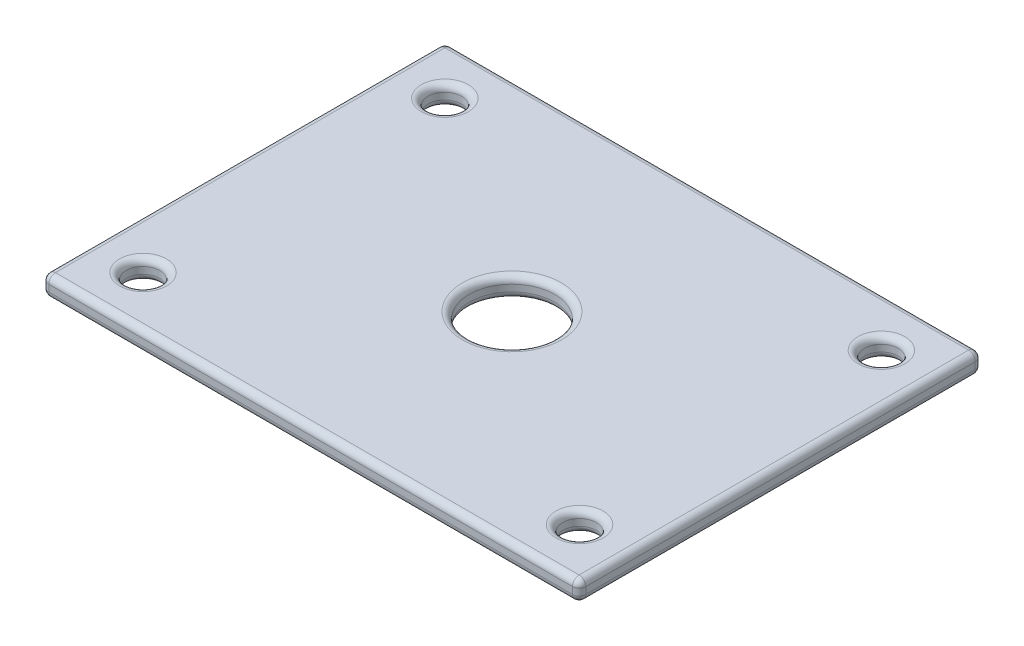
from build123d import *

# Parameters (mm, degrees)
SKETCH1_W           = 160
SKETCH1_H           = 120
BOSS_EXTRUDE1_DEPTH = 6
SKETCH2_R           = 5
SKETCH2_R_2         = 12.75
CUT_EXTRUDE1_DEPTH  = 151.018113468
FILLET1_R           = 2
SCALE_1_SCALE       = 0.5


with BuildPart() as part:
    # Sketch1 → Boss-Extrude1 (new body)
    with BuildSketch(Plane(origin=(0, 0, 0), x_dir=(1, 0, 0), z_dir=(0, 1, 0))):
        with Locations((28.264703914, -43.673469388)):
            Rectangle(SKETCH1_W, SKETCH1_H)
    extrude(amount=BOSS_EXTRUDE1_DEPTH)

    # Sketch2 → Cut-Extrude1 (cut, through all)
    with BuildSketch(Plane(origin=(0, 6, 0), x_dir=(1, 0, 0), z_dir=(0, 1, 0))):
        with Locations(Location((-36.735296086, 1.326530612, 0), (0, 0, 270))):
            Circle(SKETCH2_R)
        with Locations(Location((93.312703914, 1.326530612, 0), (0, 0, 270))):
            Circle(SKETCH2_R)
        with Locations(Location((93.312703914, -88.589469388, 0), (0, 0, 270))):
            Circle(SKETCH2_R)
        with Locations(Location((-36.735296086, -88.589469388, 0), (0, 0, 270))):
            Circle(SKETCH2_R)
        with Locations(Location((28.264703914, -43.673469388, 0), (0, 0, 270))):
            Circle(SKETCH2_R_2)
    extrude(amount=-CUT_EXTRUDE1_DEPTH, mode=Mode.SUBTRACT)

    # Fillet1
    fillet1_edges = [part.edges().sort_by_distance(p)[0] for p in [
        (108.264703914, 6, 43.673469388),
        (28.264703914, 6, -16.326530612),
        (-36.735296086, 0, -6.326530612),
        (-36.735296086, 6, -6.326530612),
        (28.264703914, 0, 30.923469388),
        (28.264703914, 6, 30.923469388),
        (93.312703914, 0, -6.326530612),
        (93.312703914, 6, -6.326530612),
        (93.312703914, 0, 83.589469388),
        (93.312703914, 6, 83.589469388),
        (-36.735296086, 0, 83.589469388),
        (-36.735296086, 6, 83.589469388),
        (-51.735296086, 6, 43.673469388),
        (28.264703914, 0, -16.326530612),
        (108.264703914, 0, 43.673469388),
        (28.264703914, 0, 103.673469388),
        (-51.735296086, 0, 43.673469388),
        (28.264703914, 6, 103.673469388),
        (-51.735296086, 3, -16.326530612),
        (108.264703914, 3, -16.326530612),
        (108.264703914, 3, 103.673469388),
        (-51.735296086, 3, 103.673469388),
    ]]
    fillet(fillet1_edges, radius=FILLET1_R)


with BuildPart() as part_1:
    # 缩放比例1: scaled about (0, 0, 0)
    add(part.part.scale(SCALE_1_SCALE))


solid = part_1.part
